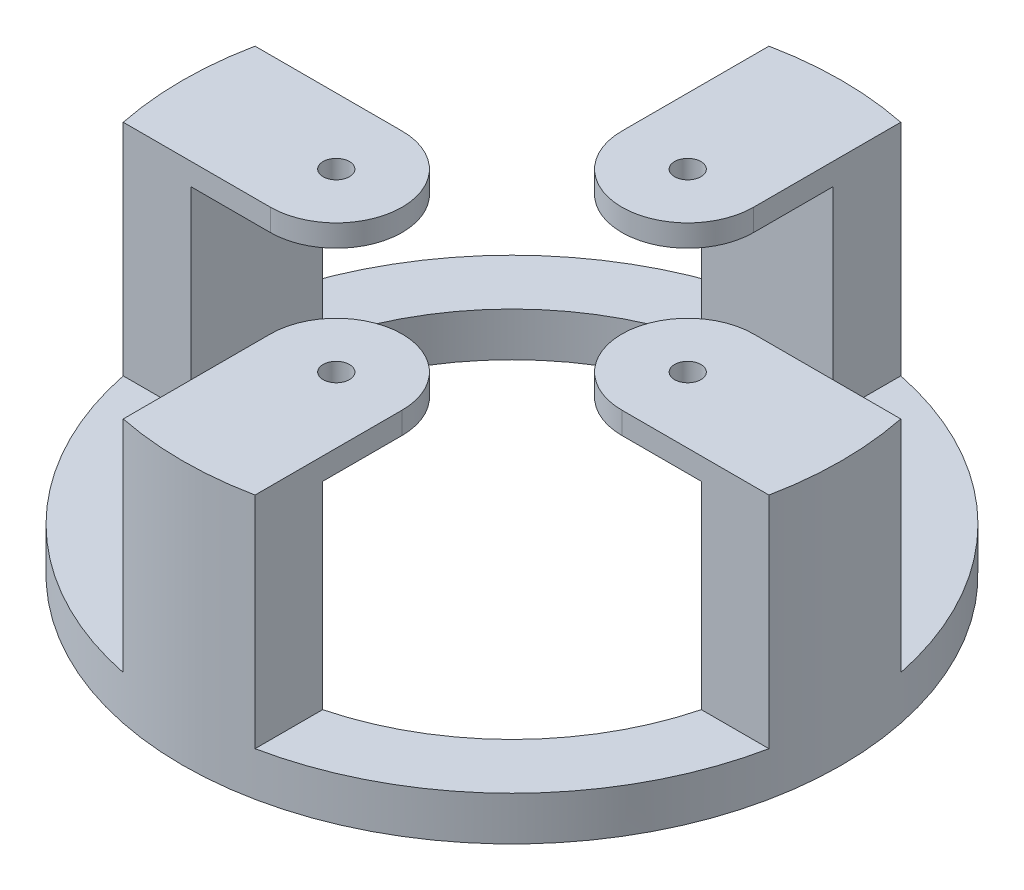
from build123d import *

# Parameters (mm, degrees)
SKETCH_1_R      = 75.00000000000001
SKETCH_1_R_2    = 60
EXTRUDE_1_DEPTH = 10
EXTRUDE_2_DEPTH = 60
EXTRUDE_START   = 55
SKETCH_3_R      = 3.0000000000000013
SKETCH_3_R_2    = 2.99999999999996
SKETCH_3_R_3    = 2.999999999999895
EXTRUDE_3_DEPTH = 5


with BuildPart() as part:
    # 草图1 → 凸台-拉伸1 (new body)
    with BuildSketch(Plane(origin=(0, 0, 0), x_dir=(1, 0, 0), z_dir=(0, 1, 0))):
        with Locations(Location((0, 0, 0), (0, 0, 270))):
            Circle(SKETCH_1_R)
        with Locations(Location((0, 0, 0), (0, 0, 270))):
            Circle(SKETCH_1_R_2, mode=Mode.SUBTRACT)
    extrude(amount=EXTRUDE_1_DEPTH)

    # 草图2 → 凸台-拉伸2 (add)
    with BuildSketch(Plane(origin=(0, 0, 0), x_dir=(1, 0, 0), z_dir=(0, 1, 0))):
        with BuildLine():
            Line((-58.09475019311125, -15), (-58.09475019311125, 15))
            Line((-58.09475019311125, 15), (-73.48469228349538, 15))
            ThreePointArc((-73.48469228349538, 15), (-75.00000000000003, 9.18e-15), (-73.48469228349538, -15))
            Line((-73.48469228349538, -15), (-58.09475019311125, -15))
        make_face()
        with BuildLine():
            Line((-14.999999999999652, -58.09475019311137), (-14.99999999999975, -73.48469228349562))
            ThreePointArc((-14.99999999999975, -73.48469228349562), (3.8762e-13, -75.00000000000017), (15.0000000000005, -73.48469228349542))
            Line((15.0000000000005, -73.48469228349542), (15.000000000000375, -58.0947501931114))
            Line((15.000000000000375, -58.0947501931114), (-14.999999999999652, -58.09475019311137))
        make_face()
        with BuildLine():
            Line((58.094750193111345, -14.999999999999556), (58.09475019311114, 15.000000000000444))
            Line((58.09475019311114, 15.000000000000444), (73.48469228349526, 15.000000000000444))
            ThreePointArc((73.48469228349526, 15.000000000000444), (75.00000000000001, 4.5589e-13), (73.48469228349548, -14.999999999999556))
            Line((73.48469228349548, -14.999999999999556), (58.094750193111345, -14.999999999999556))
        make_face()
        with BuildLine():
            Line((-14.999999999999833, 58.09475019311096), (-14.999999999999943, 73.4846922834952))
            ThreePointArc((-14.999999999999943, 73.4846922834952), (2.7105e-13, 75.00000000000016), (15.000000000000528, 73.48469228349539))
            Line((15.000000000000528, 73.48469228349539), (15.00000000000043, 58.09475019311115))
            Line((15.00000000000043, 58.09475019311115), (-14.999999999999833, 58.09475019311096))
        make_face()
    extrude(amount=EXTRUDE_2_DEPTH)

    # 草图3 → 凸台-拉伸3 (add)
    # profile 1 of 4: a face of its own
    with BuildSketch(Plane(origin=(0, 0, 0), x_dir=(1, 0, 0), z_dir=(0, 1, 0)).offset(EXTRUDE_START)):
        with BuildLine():
            Line((73.48469228349529, 15.000000000000448), (58.09475019311114, 15.000000000000444))
            Line((58.09475019311114, 15.000000000000444), (40, 15.000000000000014))
            ThreePointArc((40, 15.000000000000014), (25, 1.653e-14), (40, -14.999999999999986))
            Line((40, -14.999999999999986), (58.094750193111345, -14.999999999999556))
            Line((58.094750193111345, -14.999999999999556), (73.48469228349545, -14.999999999999556))
            ThreePointArc((73.48469228349545, -14.999999999999556), (75.00000000000001, 4.5172e-13), (73.48469228349529, 15.000000000000448))
        make_face()
        with Locations(Location((40, 1.47e-14, 0), (0, 0, 270))):
            Circle(SKETCH_3_R, mode=Mode.SUBTRACT)
    # profile 2 of 4: a face of its own
    with BuildSketch(Plane(origin=(0, 0, 0), x_dir=(1, 0, 0), z_dir=(0, 1, 0)).offset(EXTRUDE_START)):
        with BuildLine():
            Line((-73.48469228349538, -14.999999999999998), (-58.09475019311125, -15))
            Line((-58.09475019311125, -15), (-40, -15))
            ThreePointArc((-40, -15), (-25, 0), (-40, 15))
            Line((-40, 15), (-58.09475019311125, 15))
            Line((-58.09475019311125, 15), (-73.48469228349538, 15))
            ThreePointArc((-73.48469228349538, 15), (-75.00000000000003, 9.18e-15), (-73.48469228349538, -14.999999999999998))
        make_face()
        with Locations(Location((-40, 0, 0), (0, 0, 270))):
            Circle(SKETCH_3_R, mode=Mode.SUBTRACT)
    # profile 3 of 4: a face of its own
    with BuildSketch(Plane(origin=(0, 0, 0), x_dir=(1, 0, 0), z_dir=(0, 1, 0)).offset(EXTRUDE_START)):
        with BuildLine():
            Line((-14.999999999999833, 58.09475019311096), (-14.99999999999975, 73.4846922834952))
            ThreePointArc((-14.99999999999975, 73.4846922834952), (3.7097e-13, 74.99999999999982), (15.000000000000554, 73.48469228349539))
            Line((15.000000000000554, 73.48469228349539), (15.00000000000043, 58.09475019311115))
            Line((15.00000000000043, 58.09475019311115), (14.999999999999867, 39.99999999999992))
            ThreePointArc((14.999999999999867, 39.99999999999992), (6.281e-14, 25.00000000000015), (-15.00000000000016, 39.99999999999973))
            Line((-15.00000000000016, 39.99999999999973), (-14.999999999999833, 58.09475019311096))
        make_face()
        with Locations(Location((-3.469e-14, 40.00000000000005, 0), (0, 0, 270))):
            Circle(SKETCH_3_R_2, mode=Mode.SUBTRACT)
    # profile 4 of 4: a face of its own
    with BuildSketch(Plane(origin=(0, 0, 0), x_dir=(1, 0, 0), z_dir=(0, 1, 0)).offset(EXTRUDE_START)):
        with BuildLine():
            Line((-14.999999999999652, -58.09475019311137), (-14.999999999999867, -40.000000000000135))
            ThreePointArc((-14.999999999999867, -40.000000000000135), (2.6731e-13, -24.99999999999991), (15.00000000000016, -40.00000000000016))
            Line((15.00000000000016, -40.00000000000016), (15.000000000000375, -58.0947501931114))
            Line((15.000000000000375, -58.0947501931114), (15.0000000000005, -73.48469228349542))
            ThreePointArc((15.0000000000005, -73.48469228349542), (3.8762e-13, -75.00000000000017), (-14.99999999999975, -73.48469228349562))
            Line((-14.99999999999975, -73.48469228349562), (-14.999999999999652, -58.09475019311137))
        make_face()
        with Locations(Location((2.5674e-13, -40.000000000000036, 0), (0, 0, 270))):
            Circle(SKETCH_3_R_3, mode=Mode.SUBTRACT)
    extrude(amount=EXTRUDE_3_DEPTH)


solid = part.part
